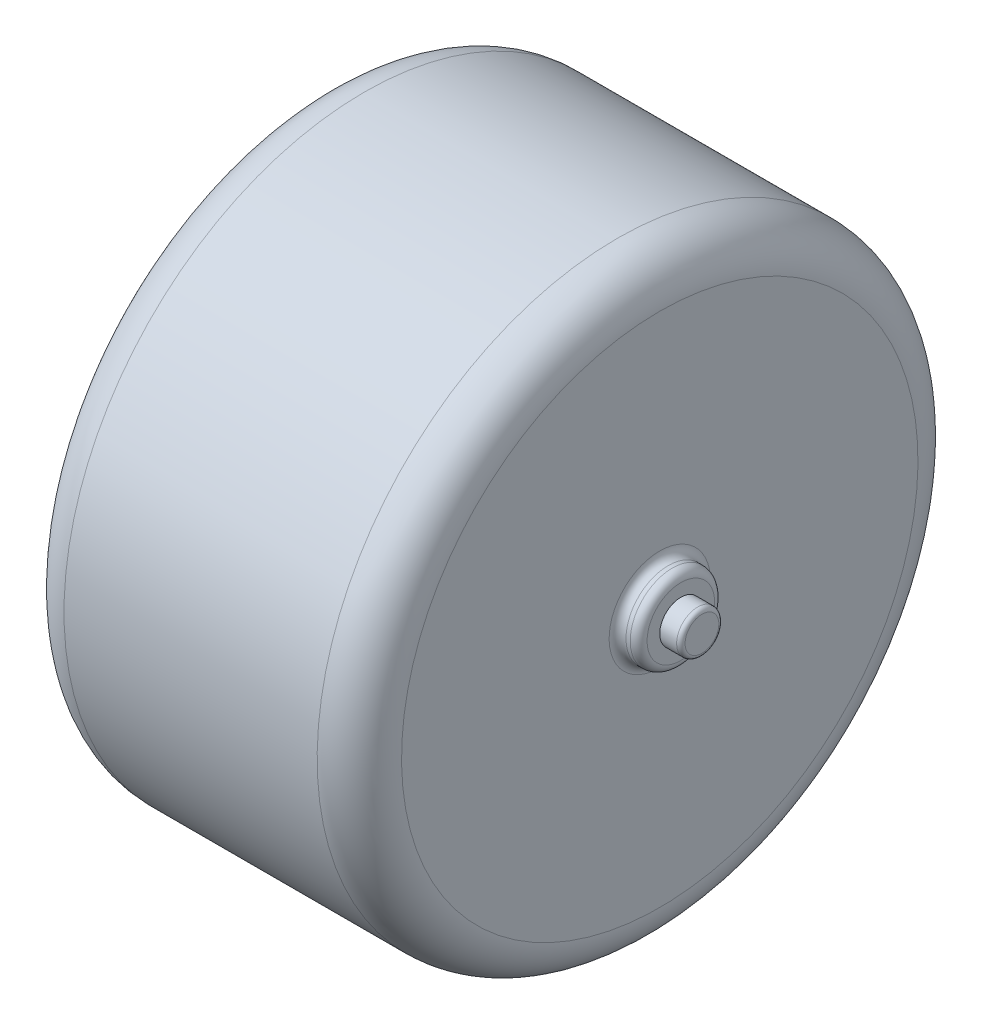
from build123d import *

# Parameters (mm, degrees)
FILLET1_R         = 12.7
FILLET2_R         = 2.54
FILLET3_R         = 1.27
CIRPATTERN1_COUNT = 3


with BuildPart() as part:
    # Sketch1 → Revolve1 (revolve)
    with BuildSketch(Plane.XY):
        Polygon((0, 0), (0, 6.35), (25.4, 6.35), (25.4, 12.7), (31.75, 12.7), (31.75, 90.430096177), (133.35, 90.430096177), (133.35, 12.7), (139.7, 12.7), (139.7, 6.35), (146.05, 6.35), (146.05, 0), align=None)
    revolve(axis=Axis((146.05, 0, 0), (-1, 0, 0)))

    # Fillet1
    fillet1_edges = [part.edges().sort_by_distance(p)[0] for p in [
        (133.35, -90.430096177, 0),
        (31.75, -90.430096177, 0),
    ]]
    fillet(fillet1_edges, radius=FILLET1_R)

    # Fillet2
    fillet2_edges = [part.edges().sort_by_distance(p)[0] for p in [
        (133.35, -12.7, 0),
        (31.75, -12.7, 0),
        (25.4, -12.7, 0),
        (139.7, -12.7, 0),
    ]]
    fillet(fillet2_edges, radius=FILLET2_R)

    # Fillet3
    fillet3_edges = [part.edges().sort_by_distance(p)[0] for p in [
        (0, -6.35, 0),
        (146.05, -6.35, 0),
    ]]
    fillet(fillet3_edges, radius=FILLET3_R)

    # Sketch3 → 3/8-16 Tapped Hole1 (revolve, cut)
    with BuildSketch(Plane(origin=(31.75, 63.5, 0), x_dir=(0, 0, 1), z_dir=(0, 1, 0))):
        Polygon((0, 0), (0, 29.372165582), (3.96875, 26.9875), (3.96875, 19.05), (4.7625, 19.05), (4.7625, 0), align=None)
    f_3_8_16_tapped_hole1 = revolve(axis=Axis((25.4, 63.5, 0), (1, 0, 0)), mode=Mode.SUBTRACT)

    # CirPattern1: 3/8-16 Tapped Hole1 ×3 about axis
    cirpattern1_axis = Axis((0, 0, 0), (1, 0, 0))
    for i in range(1, CIRPATTERN1_COUNT):
        add(f_3_8_16_tapped_hole1.rotate(cirpattern1_axis, i * 360 / CIRPATTERN1_COUNT), mode=Mode.SUBTRACT)


solid = part.part
